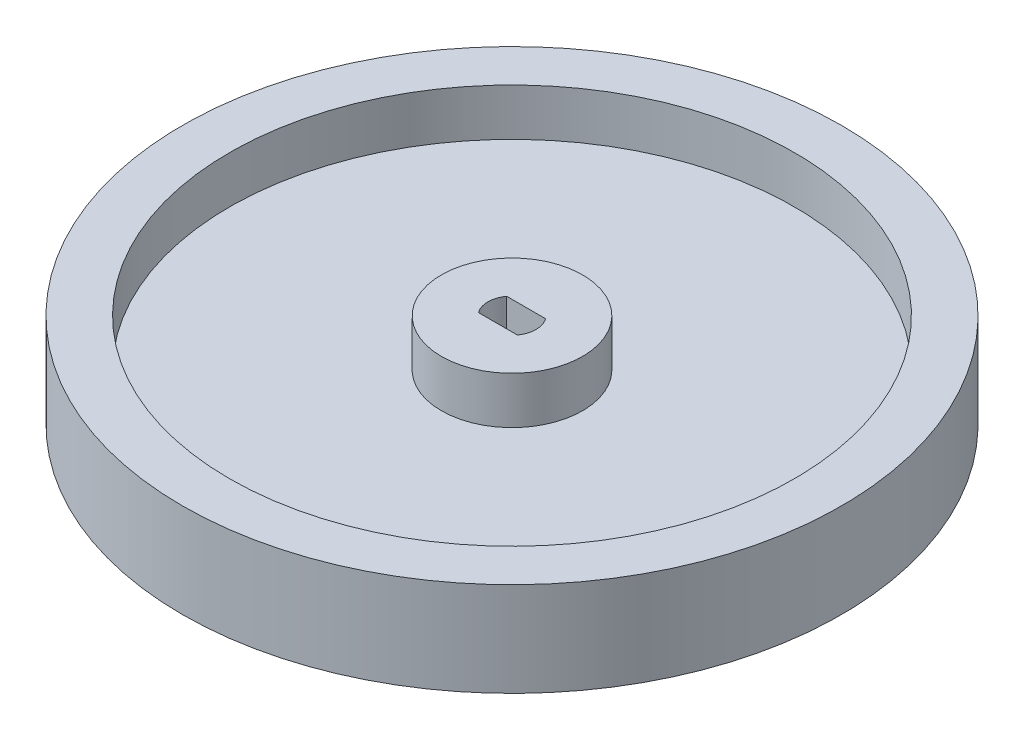
from build123d import *

# Parameters (mm, degrees)
IZIM1_R                     = 35
Y_KSEKLIK_EKSTR_ZYON1_DEPTH = 5
IZIM2_R                     = 7.5
Y_KSEKLIK_EKSTR_ZYON2_DEPTH = 5
KES_EKSTR_ZYON1_START       = -4
KES_EKSTR_ZYON1_DEPTH       = 4
IZIM4_R                     = 1.5
KES_EKSTR_ZYON2_DEPTH       = 4
IZIM5_R                     = 35
IZIM5_R_2                   = 30
Y_KSEKLIK_EKSTR_ZYON3_DEPTH = 5


with BuildPart() as part:
    # Çizim1 → Yükseklik-Ekstrüzyon1 (new body)
    with BuildSketch(Plane(origin=(0, 0, 0), x_dir=(1, 0, 0), z_dir=(0, 1, 0))):
        with Locations(Location((0, 0, 0), (0, 0, 270))):
            Circle(IZIM1_R)
    extrude(amount=Y_KSEKLIK_EKSTR_ZYON1_DEPTH)

    # Çizim2 → Yükseklik-Ekstrüzyon2 (add)
    with BuildSketch(Plane(origin=(0, 5, 0), x_dir=(1, 0, 0), z_dir=(0, 1, 0))):
        with Locations(Location((0, 0, 0), (0, 0, 270))):
            Circle(IZIM2_R)
        with BuildLine():
            Line((-2.062159063, 1.5), (2.062159063, 1.5))
            ThreePointArc((2.062159063, 1.5), (2.55, 0), (2.062159063, -1.5))
            Line((2.062159063, -1.5), (-2.062159063, -1.5))
            ThreePointArc((-2.062159063, -1.5), (-2.55, 0), (-2.062159063, 1.5))
        make_face(mode=Mode.SUBTRACT)
    extrude(amount=Y_KSEKLIK_EKSTR_ZYON2_DEPTH)

    # Çizim3 → Kes-Ekstrüzyon1 (cut)
    with BuildSketch(Plane(origin=(0, 5, 0), x_dir=(1, 0, 0), z_dir=(0, 1, 0)).offset(KES_EKSTR_ZYON1_START)):
        with BuildLine():
            Line((-2.062159063, 1.5), (2.062159063, 1.5))
            ThreePointArc((2.062159063, 1.5), (2.55, 0), (2.062159063, -1.5))
            Line((2.062159063, -1.5), (-2.062159063, -1.5))
            ThreePointArc((-2.062159063, -1.5), (-2.55, 0), (-2.062159063, 1.5))
        make_face()
    extrude(amount=KES_EKSTR_ZYON1_DEPTH, mode=Mode.SUBTRACT)

    # Çizim4 → Kes-Ekstrüzyon2 (cut)
    with BuildSketch(Plane(origin=(0, 1, 0), x_dir=(1, 0, 0), z_dir=(0, 1, 0))):
        with Locations(Location((0, 0, 0), (0, 0, 270))):
            Circle(IZIM4_R)
    extrude(amount=-KES_EKSTR_ZYON2_DEPTH, mode=Mode.SUBTRACT)

    # Çizim5 → Yükseklik-Ekstrüzyon3 (add)
    with BuildSketch(Plane(origin=(0, 5, 0), x_dir=(1, 0, 0), z_dir=(0, 1, 0))):
        with Locations(Location((0, 0, 0), (0, 0, 270))):
            Circle(IZIM5_R)
        with Locations(Location((0, 0, 0), (0, 0, 270))):
            Circle(IZIM5_R_2, mode=Mode.SUBTRACT)
    extrude(amount=Y_KSEKLIK_EKSTR_ZYON3_DEPTH)


solid = part.part
